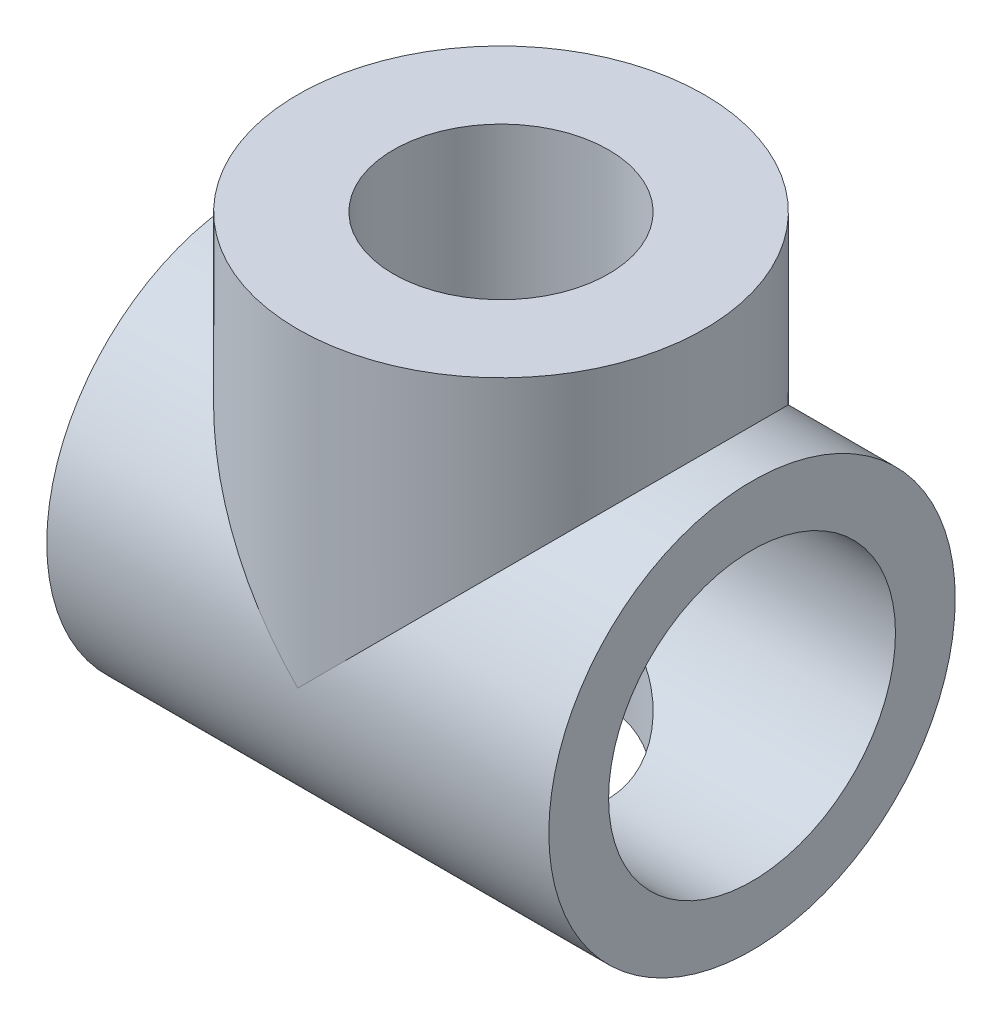
from build123d import *

# Parameters (mm, degrees)
SKETCH_1_R               = 17
EXTRUDE_1_DEPTH          = 26
EXTRUDE_2_DEPTH          = 21
EXTRUDE_2_DEPTH_BACK     = 21
SKETCH_2_R               = 17
CUT_EXTRUDE_2_DEPTH      = 21
CUT_EXTRUDE_2_DEPTH_BACK = 21
SKETCH_4_R               = 12
CUT_EXTRUDE_3_DEPTH      = 26
CUT_EXTRUDE_3_DEPTH_BACK = 17
SKETCH_5_R               = 9


with BuildPart() as part:
    # 草图1 → 凸台-拉伸1 (new body)
    with BuildSketch(Plane(origin=(0, 0, 0), x_dir=(1, 0, 0), z_dir=(0, 1, 0))):
        Circle(SKETCH_1_R)
    extrude(amount=EXTRUDE_1_DEPTH)

    # 草图2 → 凸台-拉伸2 (add, two sides: drawn at the far end of the back side and taken through both)
    with BuildSketch(Plane(origin=(0, 0, 0), x_dir=(0, 0, -1), z_dir=(1, 0, 0)).offset(-EXTRUDE_2_DEPTH_BACK)):
        Circle(SKETCH_2_R)
    extrude(amount=EXTRUDE_2_DEPTH + EXTRUDE_2_DEPTH_BACK)

    # 草图4 → 切除-拉伸2 (cut, two sides: drawn at the far end of the back side and taken through both)
    with BuildSketch(Plane(origin=(0, 0, 0), x_dir=(0, 0, -1), z_dir=(1, 0, 0)).offset(-CUT_EXTRUDE_2_DEPTH_BACK)):
        Circle(SKETCH_4_R)
    extrude(amount=CUT_EXTRUDE_2_DEPTH + CUT_EXTRUDE_2_DEPTH_BACK, mode=Mode.SUBTRACT)

    # 草图5 → 切除-拉伸3 (cut, two sides: drawn at the far end of the back side and taken through both)
    with BuildSketch(Plane(origin=(0, 0, 0), x_dir=(1, 0, 0), z_dir=(0, 1, 0)).offset(-CUT_EXTRUDE_3_DEPTH_BACK)):
        Circle(SKETCH_5_R)
    extrude(amount=CUT_EXTRUDE_3_DEPTH + CUT_EXTRUDE_3_DEPTH_BACK, mode=Mode.SUBTRACT)


solid = part.part
